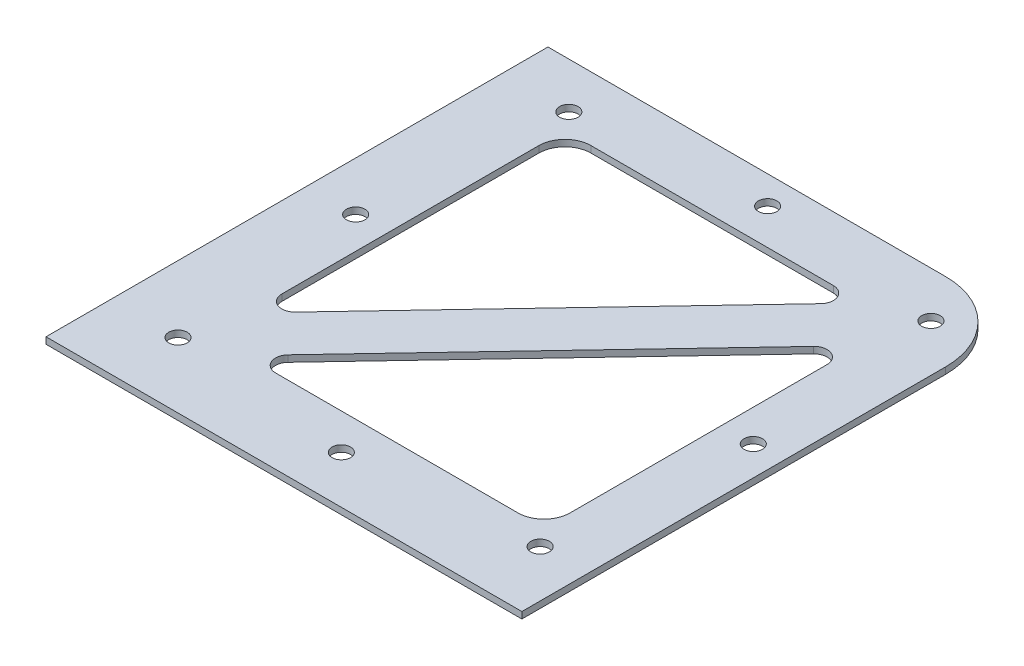
from build123d import *

# Parameters (mm, degrees)
SKETCH2_W            = 115.8875
SKETCH2_H            = 122.2375
BOSS_EXTRUDE4_DEPTH  = 1.5875
M4_CLEARANCE_HOLE1_D = 4.5
FILLET1_R            = 19.05
FILLET2_R            = 6.35
FILLET3_R            = 3.175


with BuildPart() as part:
    # Sketch2 → Boss-Extrude4 (new body)
    with BuildSketch(Plane(origin=(0, 0, 0), x_dir=(1, 0, 0), z_dir=(0, 1, 0))):
        with Locations((-95.437748261, 114.593960112)):
            Rectangle(SKETCH2_W, SKETCH2_H)
        Polygon((-133.696498261, 160.155210112), (-60.951469128, 160.155210112), (-133.696498261, 83.253322171), align=None, mode=Mode.SUBTRACT)
        Polygon((-52.416498261, 150.697098052), (-52.416498261, 73.795210112), (-125.161527393, 73.795210112), align=None, mode=Mode.SUBTRACT)
    extrude(amount=BOSS_EXTRUDE4_DEPTH)

    # M4 Clearance Hole1 (through all)
    with Locations(Plane(origin=(0, 1.5875, 0), x_dir=(1, 0, 0), z_dir=(0, 1, 0))):
        with Locations((-93.056498261, 65.065510112), (-137.14786851, 69.38383987), (-141.466198251, 116.975210121), (-137.147868492, 164.56658037), (-93.056498242, 168.884910112), (-48.965127993, 164.566580353), (-44.646798251, 116.975210102), (-48.965128011, 69.383839853)):
            Hole(M4_CLEARANCE_HOLE1_D / 2)

    # Fillet1
    fillet1_edges = [part.edges().sort_by_distance(p)[0] for p in [
        (-37.493998261, 0.79375, -175.712710112),
    ]]
    fillet(fillet1_edges, radius=FILLET1_R)

    # Fillet2
    fillet2_edges = [part.edges().sort_by_distance(p)[0] for p in [
        (-133.696498261, 0.79375, -160.155210112),
        (-52.416498261, 0.79375, -73.795210112),
    ]]
    fillet(fillet2_edges, radius=FILLET2_R)

    # Fillet3
    fillet3_edges = [part.edges().sort_by_distance(p)[0] for p in [
        (-133.696498261, 0.79375, -83.253322171),
        (-60.951469128, 0.79375, -160.155210112),
        (-125.161527393, 0.79375, -73.795210112),
        (-52.416498261, 0.79375, -150.697098052),
    ]]
    fillet(fillet3_edges, radius=FILLET3_R)


solid = part.part
